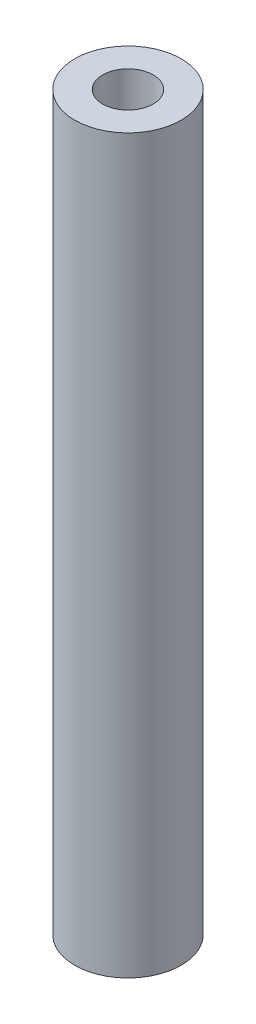
from build123d import *

# Parameters (mm, degrees)
SKETCH_1_R      = 4
SKETCH_1_R_2    = 1.9
EXTRUDE_1_DEPTH = 55


with BuildPart() as part:
    # 草图1 → 凸台-拉伸1 (new body)
    with BuildSketch(Plane(origin=(0, 0, 0), x_dir=(1, 0, 0), z_dir=(0, 1, 0))):
        with Locations(Location((0, 0, 0), (0, 0, 270))):
            Circle(SKETCH_1_R)
        with Locations(Location((0, 0, 0), (0, 0, 270))):
            Circle(SKETCH_1_R_2, mode=Mode.SUBTRACT)
    extrude(amount=EXTRUDE_1_DEPTH)


solid = part.part
